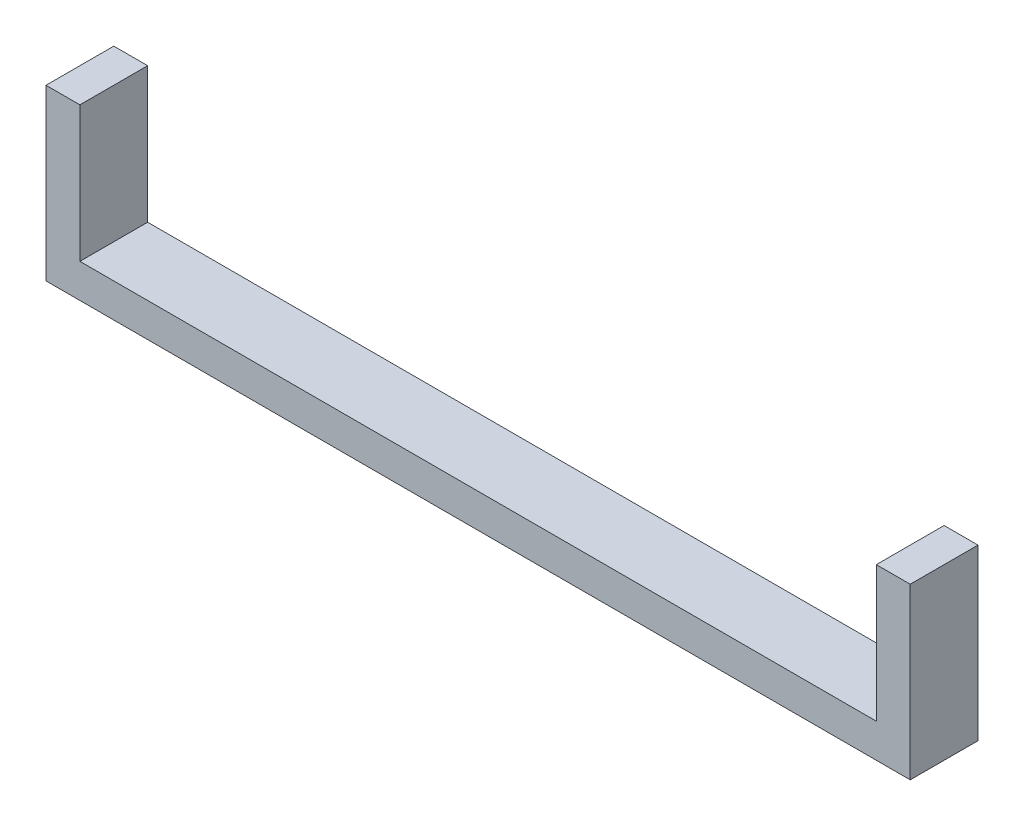
from build123d import *

# Parameters (mm, degrees)
BOSS_EXTRUDE1_DEPTH = 25.4


with BuildPart() as part:
    # Sketch1 → Boss-Extrude1 (new body)
    with BuildSketch(Plane.XY):
        Polygon((0, 0), (323.85, 0), (323.85, 63.5), (311.15, 63.5), (311.15, 12.7), (12.7, 12.7), (12.7, 63.5), (0, 63.5), align=None)
    extrude(amount=BOSS_EXTRUDE1_DEPTH)


solid = part.part
